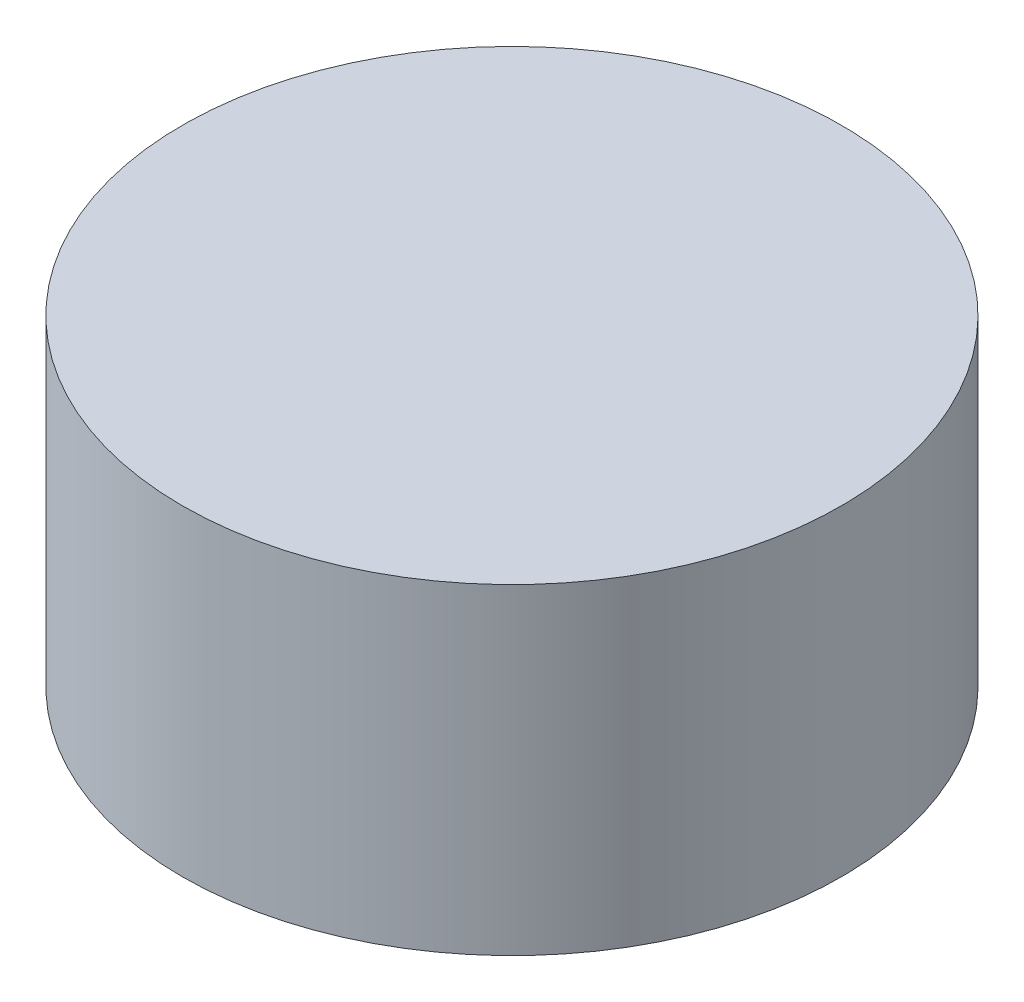
from build123d import *

# Parameters (mm, degrees)
SKETCH1_R           = 2
BOSS_EXTRUDE1_DEPTH = 1.95


with BuildPart() as part:
    # Sketch1 → Boss-Extrude1 (new body)
    with BuildSketch(Plane(origin=(0, 0, 0), x_dir=(1, 0, 0), z_dir=(0, 1, 0))):
        with Locations(Location((0, 0, 0), (0, 0, 270))):
            Circle(SKETCH1_R)
    extrude(amount=BOSS_EXTRUDE1_DEPTH)


solid = part.part
